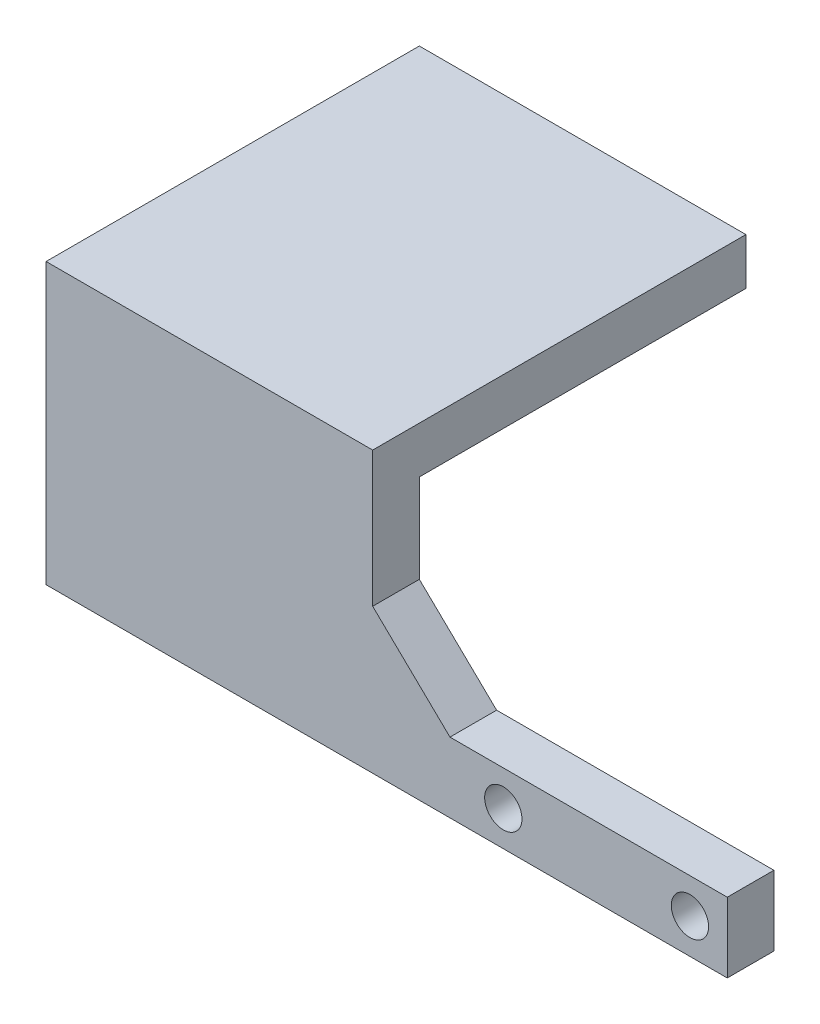
from build123d import *

# Parameters (mm, degrees)
SKETCH1_R           = 2
BOSS_EXTRUDE1_DEPTH = 5
BOSS_EXTRUDE2_DEPTH = 35
CHAMFER1_SIZE       = 8
CHAMFER1_SIZE2      = 8.28424251


with BuildPart() as part:
    # Sketch1 → Boss-Extrude1 (new body)
    with BuildSketch(Plane.XY):
        Polygon((-14, 3.75), (14, 3.75), (14, -3.75), (-14, -3.75), (-59, -3.75), (-59, 3.75), align=None)
        with Locations((-10, 0)):
            Circle(SKETCH1_R, mode=Mode.SUBTRACT)
        with Locations((10, 0)):
            Circle(SKETCH1_R, mode=Mode.SUBTRACT)
    extrude(amount=BOSS_EXTRUDE1_DEPTH)

    # Sketch2 → Boss-Extrude2 (add)
    with BuildSketch(Plane.ZY.offset(59)):
        Polygon((0, 3.75), (0, 21.25), (-35, 21.25), (-35, 26.25), (5, 26.25), (5, 3.75), align=None)
    extrude(amount=-BOSS_EXTRUDE2_DEPTH)

    # Chamfer1
    chamfer1_edges = [part.edges().sort_by_distance(p)[0] for p in [
        (-24, 3.75, 2.5),
    ]]
    chamfer1_side = [part.faces().sort_by_distance(p)[0] for p in [
        (-24, 12.5, 0.458938994),
    ]]
    chamfer(chamfer1_edges, length=CHAMFER1_SIZE, length2=CHAMFER1_SIZE2, reference=chamfer1_side[0])


solid = part.part
